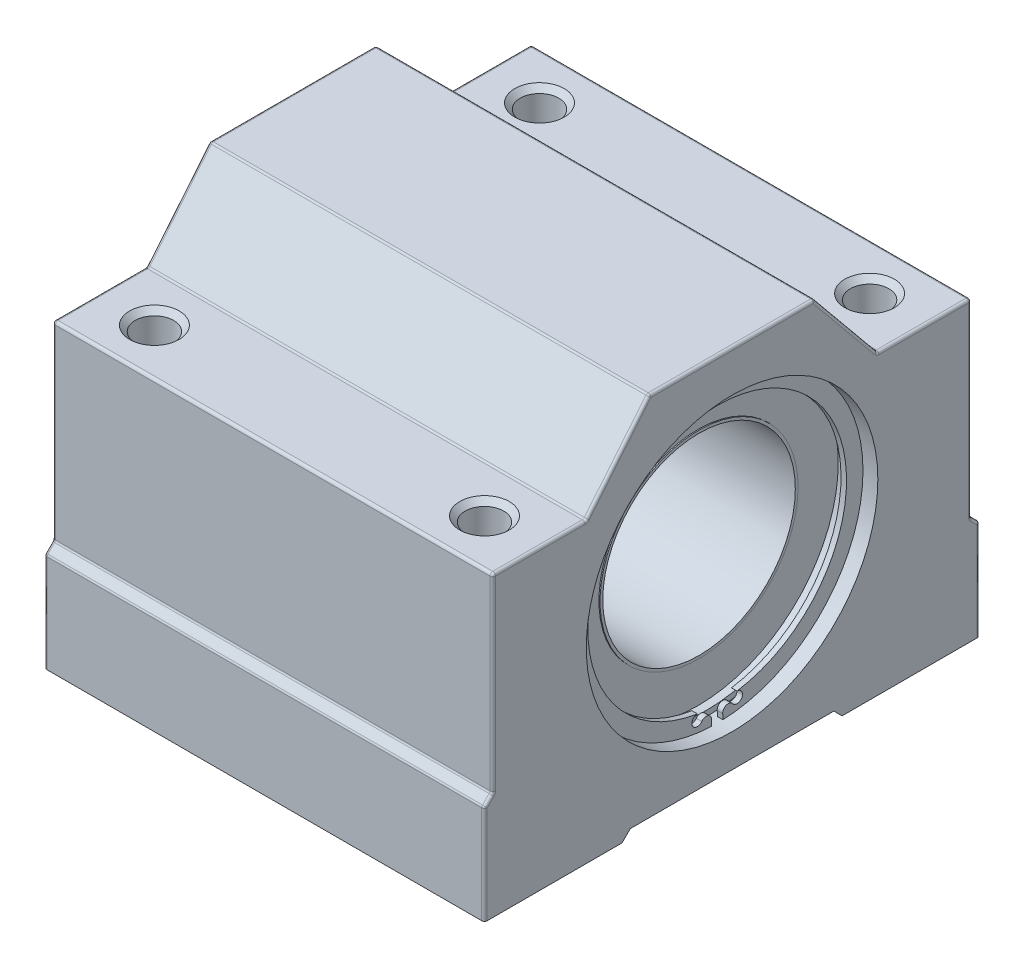
from build123d import *

# Parameters (mm, degrees)
SKETCH1_R           = 26.5
BOSS_EXTRUDE1_DEPTH = 80
EXTRUDE_THIN1_START = 0.5
SKETCH1_4_R         = 18
SKETCH1_4_R_2       = 17.5
EXTRUDE_THIN1_DEPTH = 73.5
BOSS_EXTRUDE2_START = 0.8
SKETCH1_5_R         = 25.5
SKETCH1_5_R_2       = 17.5
BOSS_EXTRUDE2_DEPTH = 73
BOSS_EXTRUDE3_START = 0.3
SKETCH1_6_R         = 26.5
SKETCH1_6_R_2       = 25.5
BOSS_EXTRUDE3_DEPTH = 75
BOSS_EXTRUDE4_START = 1
BOSS_EXTRUDE4_DEPTH = 1
FILLET1_R           = 0.5
SKETCH4_R           = 3.5
CUT_EXTRUDE3_DEPTH  = 115.232219623
CHAMFER1_SIZE       = 1


with BuildPart() as part:
    # Sketch1 → Boss-Extrude1 (new body)
    with BuildSketch(Plane(origin=(0, 0, 0), x_dir=(0, 0, -1), z_dir=(1, 0, 0))):
        Polygon((-45, -34), (-20, -34), (-18.5, -32.5), (18.5, -32.5), (20, -34), (45, -34), (45, -16), (43.5, -14.5), (43.5, 20), (26.5, 20), (15, 34), (-15, 34), (-26.5, 20), (-43.5, 20), (-43.5, -14.5), (-45, -16), align=None)
        Circle(SKETCH1_R, mode=Mode.SUBTRACT)
    extrude(amount=BOSS_EXTRUDE1_DEPTH)



with BuildPart() as body_2:
    # Sketch1<4> → Extrude-Thin1 (new body)
    with BuildSketch(Plane(origin=(0, 0, 0), x_dir=(0, 0, -1), z_dir=(1, 0, 0)).offset(EXTRUDE_THIN1_START)):
        Circle(SKETCH1_4_R)
        Circle(SKETCH1_4_R_2, mode=Mode.SUBTRACT)
    extrude(amount=EXTRUDE_THIN1_DEPTH)

    # Sketch1<5> → Boss-Extrude2 (add)
    with BuildSketch(Plane(origin=(0, 0, 0), x_dir=(0, 0, -1), z_dir=(1, 0, 0)).offset(BOSS_EXTRUDE2_START)):
        Circle(SKETCH1_5_R)
        Circle(SKETCH1_5_R_2, mode=Mode.SUBTRACT)
    extrude(amount=BOSS_EXTRUDE2_DEPTH)


with BuildPart() as part_1:
    add(part.part)

    add(body_2.part)  # Boss-Extrude3 merges body 2
    # Sketch1<6> → Boss-Extrude3 (add)
    with BuildSketch(Plane(origin=(0, 0, 0), x_dir=(0, 0, -1), z_dir=(1, 0, 0)).offset(BOSS_EXTRUDE3_START)):
        Circle(SKETCH1_6_R)
        Circle(SKETCH1_6_R_2, mode=Mode.SUBTRACT)
    extrude(amount=BOSS_EXTRUDE3_DEPTH)

    # Sketch3 → Boss-Extrude4 (add)
    with BuildSketch(Plane(origin=(75.3, 0, 0), x_dir=(0, 0, -1), z_dir=(1, 0, 0)).offset(BOSS_EXTRUDE4_START)):
        with BuildLine():
            Line((-1.001734275, -25.48031649), (-1.041017972, -26.479544588))
            ThreePointArc((-1.041017972, -26.479544588), (0, 26.5), (1.041017972, -26.479544588))
            Line((1.041017972, -26.479544588), (1.001734275, -25.48031649))
            ThreePointArc((1.001734275, -25.48031649), (1.659300342, -24.48127545), (2.804229139, -24.827128286))
            ThreePointArc((2.804229139, -24.827128286), (4.503052889, -24.679687533), (3.600627291, -23.232839597))
            ThreePointArc((3.600627291, -23.232839597), (0, 23.51019678), (-3.600627291, -23.232839597))
            ThreePointArc((-3.600627291, -23.232839597), (-4.503052889, -24.679687533), (-2.804229139, -24.827128286))
            ThreePointArc((-2.804229139, -24.827128286), (-1.659300342, -24.48127545), (-1.001734275, -25.48031649))
        make_face()
    extrude(amount=BOSS_EXTRUDE4_DEPTH)

    # Fillet1
    fillet1_edges = [part_1.edges().sort_by_distance(p)[0] for p in [
        (40, -14.5, -43.5),
        (40, -14.5, 43.5),
        (40, -16, 45),
        (40, -16, -45),
        (40, 20, -26.5),
        (40, 20, 26.5),
        (40, 34, 15),
        (40, 34, -15),
        (40, 20, -43.5),
        (40, 20, 43.5),
        (80, 27, -20.75),
        (80, 27, 20.75),
        (80, 2.75, 43.5),
        (0, -15.25, 44.25),
        (0, 27, 20.75),
        (80, -15.25, -44.25),
        (80, -25, -45),
        (80, 2.75, -43.5),
        (80, 34, 0),
        (80, 20, -35),
        (80, 20, 35),
        (80, -15.25, 44.25),
        (80, -25, 45),
        (0, -25, -45),
        (0, -15.25, -44.25),
        (0, 2.75, -43.5),
        (0, 27, -20.75),
        (0, 20, -35),
        (0, 34, 0),
        (0, -25, 45),
        (0, 2.75, 43.5),
        (0, 20, 35),
    ]]
    fillet(fillet1_edges, radius=FILLET1_R)

    # Sketch4 → Cut-Extrude3 (cut, through all)
    with BuildSketch(Plane.XZ.offset(34)):
        with Locations((10, 35)):
            Circle(SKETCH4_R)
        with Locations((70, 35)):
            Circle(SKETCH4_R)
        with Locations((70, -35)):
            Circle(SKETCH4_R)
        with Locations((10, -35)):
            Circle(SKETCH4_R)
    extrude(amount=-CUT_EXTRUDE3_DEPTH, mode=Mode.SUBTRACT)

    # Chamfer1
    chamfer1_edges = [part_1.edges().sort_by_distance(p)[0] for p in [
        (66.5, 20, -35),
        (6.5, 20, -35),
        (6.5, 20, 35),
        (66.5, 20, 35),
        (66.5, -34, 35),
        (6.5, -34, 35),
    ]]
    chamfer(chamfer1_edges, length=CHAMFER1_SIZE)


solid = part_1.part
